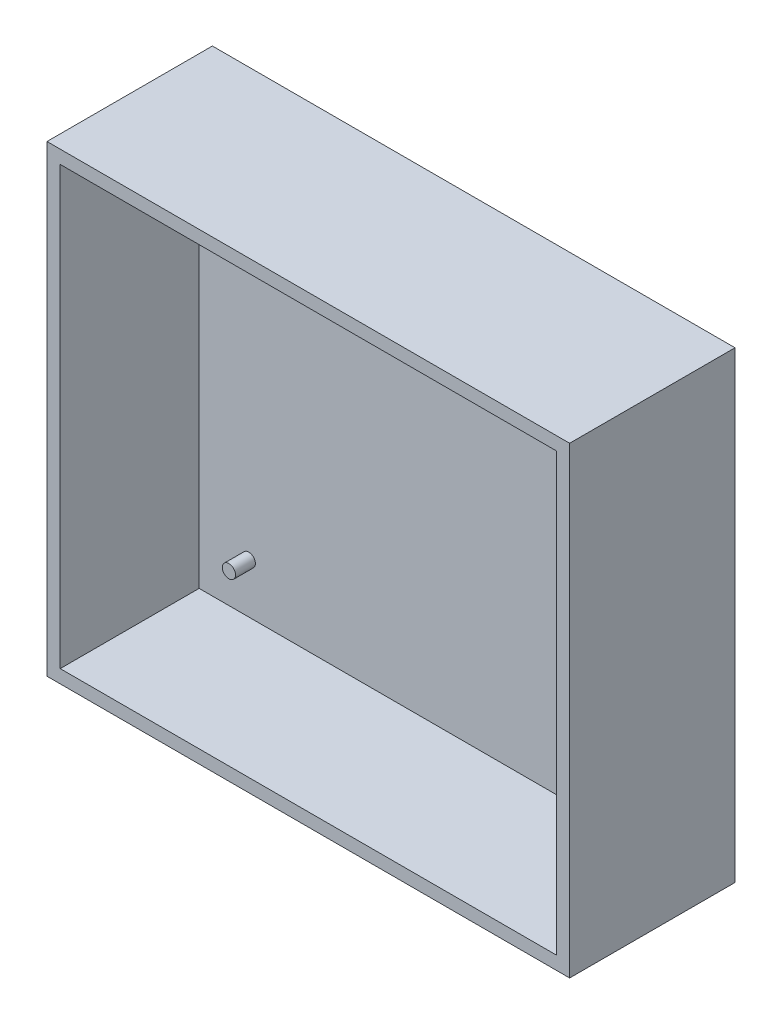
from build123d import *

# Parameters (mm, degrees)
ESQUISSE1_W        = 75
ESQUISSE1_H        = 66
BOSS_EXTRU_1_DEPTH = 4
ESQUISSE2_R        = 1
BOSS_EXTRU_2_DEPTH = 3
ESQUISSE3_W        = 79
ESQUISSE3_H        = 70
ESQUISSE3_W_2      = 75
ESQUISSE3_H_2      = 66
BOSS_EXTRU_3_DEPTH = 25


with BuildPart() as part:
    # Esquisse1 → Boss.-Extru.1 (new body)
    with BuildSketch(Plane.XY):
        with Locations((37.5, 33)):
            Rectangle(ESQUISSE1_W, ESQUISSE1_H)
    extrude(amount=BOSS_EXTRU_1_DEPTH)

    # Esquisse2 → Boss.-Extru.2 (add)
    with BuildSketch(Plane.XY.offset(4)):
        with Locations(Location((67.5, 7.5, 0), (0, 0, 180))):
            Circle(ESQUISSE2_R)
        with Locations(Location((67.5, 58.5, 0), (0, 0, 180))):
            Circle(ESQUISSE2_R)
        with Locations(Location((7.5, 58.5, 0), (0, 0, 180))):
            Circle(ESQUISSE2_R)
        with Locations(Location((7.5, 7.5, 0), (0, 0, 180))):
            Circle(ESQUISSE2_R)
    extrude(amount=BOSS_EXTRU_2_DEPTH)

    # Esquisse3 → Boss.-Extru.3 (add)
    with BuildSketch(Plane(origin=(0, 0, 0), x_dir=(-1, 0, 0), z_dir=(0, 0, -1))):
        with Locations((-37.5, 33)):
            Rectangle(ESQUISSE3_W, ESQUISSE3_H)
        with Locations((-37.5, 33)):
            Rectangle(ESQUISSE3_W_2, ESQUISSE3_H_2, mode=Mode.SUBTRACT)
    extrude(amount=-BOSS_EXTRU_3_DEPTH)


solid = part.part
